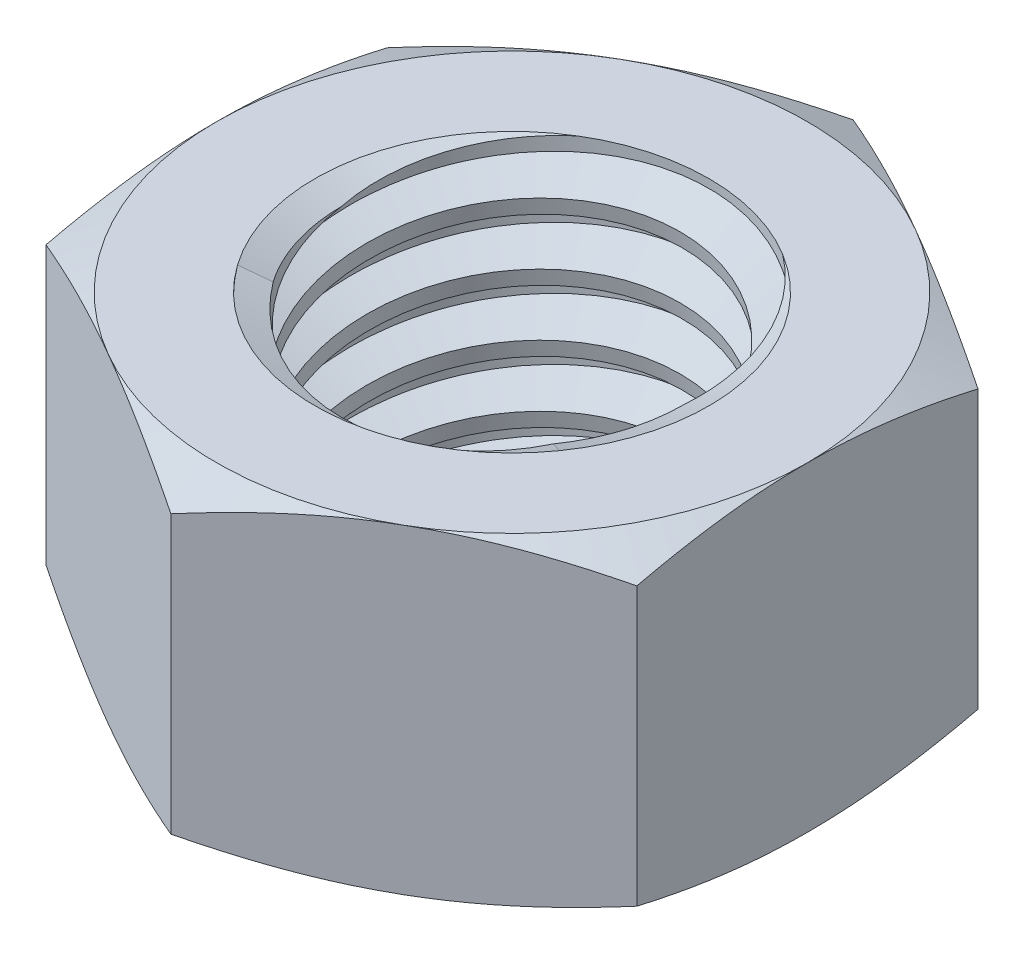
from build123d import *

# Parameters (mm, degrees)
EXTRUDE1_DEPTH       = 3.25
SKETCH2_W            = 4
SKETCH2_H            = 6.5
LPATTERN1_COUNT      = 5
LPATTERN1_PITCH      = 1.25
LPATTERN1_COUNT_DIR2 = 2
LPATTERN1_PITCH_DIR2 = 1.25


with BuildPart() as part:
    # Sketch1 → Extrude1 (new, symmetric)
    with BuildSketch(Plane(origin=(0, 0, 0), x_dir=(1, 0, 0), z_dir=(0, 1, 0))):
        Polygon((0, 6.92820323), (-6, 3.464101615), (-6, -3.464101615), (0, -6.92820323), (6, -3.464101615), (6, 3.464101615), align=None)
    extrude(amount=EXTRUDE1_DEPTH, both=True)

    # Sketch4 → Cut-Revolve2 (revolve, cut)
    with BuildSketch(Plane(origin=(0, 0, 0), x_dir=(0, 0, -1), z_dir=(1, 0, 0))):
        Polygon((0, 3.25), (4, 3.25), (3.415953356, 2.977654577), (3.415953356, -2.977654577), (4, -3.25), (0, -3.25), align=None)
    revolve(axis=Axis((0, 3.25, 0), (0, 1, 0)), mode=Mode.SUBTRACT)


with BuildPart() as body_2:
    # Sketch2 → Revolve1 (revolve)
    with BuildSketch(Plane(origin=(0, 0, 0), x_dir=(0, 0, -1), z_dir=(1, 0, 0))):
        with Locations((2, 0)):
            Rectangle(SKETCH2_W, SKETCH2_H)
    revolve(axis=Axis((0, -7.25, 0), (0, 1, 0)))

    # Sketch3 → Cut-Revolve1 (revolve, cut)
    with BuildSketch(Plane(origin=(0, 0, 0), x_dir=(0, 0, -1), z_dir=(1, 0, 0))):
        Polygon((4.024121388, 3.09562312), (4.1929711, 2.014984958), (3.464196131, 2.296478487), (3.415953356, 2.605232247), align=None)
    cut_revolve1 = revolve(axis=Axis((0, 3.25, 0.208852549), (0, -0.9880120337511015, -0.15437688027360996)), mode=Mode.SUBTRACT)

    # LPattern1: Cut-Revolve1 5 × 2
    with Locations(*[Vector(0, -1, 0) * (i * LPATTERN1_PITCH) + Vector(0, 1, 0) * (j * LPATTERN1_PITCH_DIR2) for i in range(LPATTERN1_COUNT) for j in range(LPATTERN1_COUNT_DIR2) if (i, j) != (0, 0)]):
        add(cut_revolve1, mode=Mode.SUBTRACT)


with BuildPart() as part_1:
    add(part.part)

    # Combine1: cut body 2
    add(body_2.part, mode=Mode.SUBTRACT)

    # Sketch5 → Cut-Revolve3 (revolve, cut)
    with BuildSketch(Plane(origin=(0, 0, 0), x_dir=(0, 0, -1), z_dir=(1, 0, 0))):
        Polygon((0, -3.25), (6, -3.25), (6.92820323, -2.817171725), (6.92820323, 2.817171725), (6, 3.25), (0, 3.25), (0, 4.52), (8.19820323, 4.52), (8.19820323, -4.52), (0, -4.52), align=None)
    revolve(axis=Axis((0, -3.25, 0), (0, 1, 0)), mode=Mode.SUBTRACT)


solid = part_1.part
